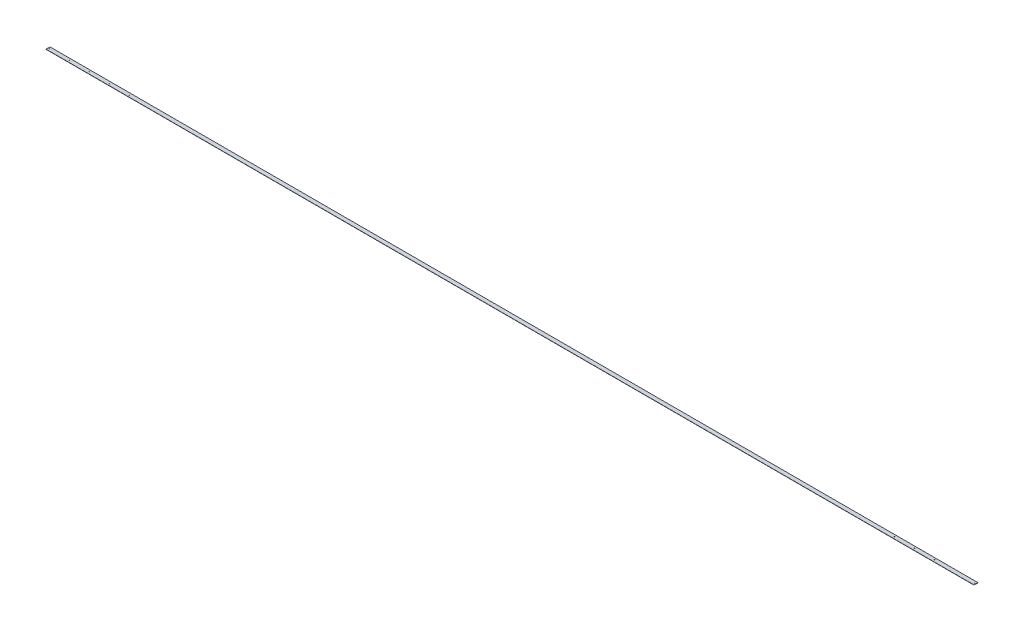
from build123d import *

# Parameters (mm, degrees)
SKETCH1_W           = 9850
SKETCH1_H           = 42
BOSS_EXTRUDE1_DEPTH = 2
SKETCH2_R           = 3.4
CUT_EXTRUDE1_DEPTH  = 10


with BuildPart() as part:
    # Sketch1 → Boss-Extrude1 (new body)
    with BuildSketch(Plane(origin=(0, 0, 0), x_dir=(1, 0, 0), z_dir=(0, 1, 0))):
        Rectangle(SKETCH1_W, SKETCH1_H)
    extrude(amount=BOSS_EXTRUDE1_DEPTH)

    # Sketch2 → Cut-Extrude1 (cut)
    with BuildSketch(Plane(origin=(0, 2, 0), x_dir=(1, 0, 0), z_dir=(0, 1, 0))):
        with Locations(Location((-4910, -1, 0), (0, 0, 270))):
            Circle(SKETCH2_R)
        with Locations(Location((-4697.5, -1, 0), (0, 0, 270))):
            Circle(SKETCH2_R)
        with Locations(Location((-4485, -1, 0), (0, 0, 270))):
            Circle(SKETCH2_R)
        with Locations(Location((-4272.5, -1, 0), (0, 0, 270))):
            Circle(SKETCH2_R)
        with Locations(Location((-4060, -1, 0), (0, 0, 270))):
            Circle(SKETCH2_R)
        with Locations(Location((4910, -1, 0), (0, 0, 270))):
            Circle(SKETCH2_R)
        with Locations(Location((4697.5, -1, 0), (0, 0, 270))):
            Circle(SKETCH2_R)
        with Locations(Location((4485, -1, 0), (0, 0, 270))):
            Circle(SKETCH2_R)
        with Locations(Location((4272.5, -1, 0), (0, 0, 270))):
            Circle(SKETCH2_R)
        with Locations(Location((4060, -1, 0), (0, 0, 270))):
            Circle(SKETCH2_R)
    extrude(amount=-CUT_EXTRUDE1_DEPTH, mode=Mode.SUBTRACT)


solid = part.part
